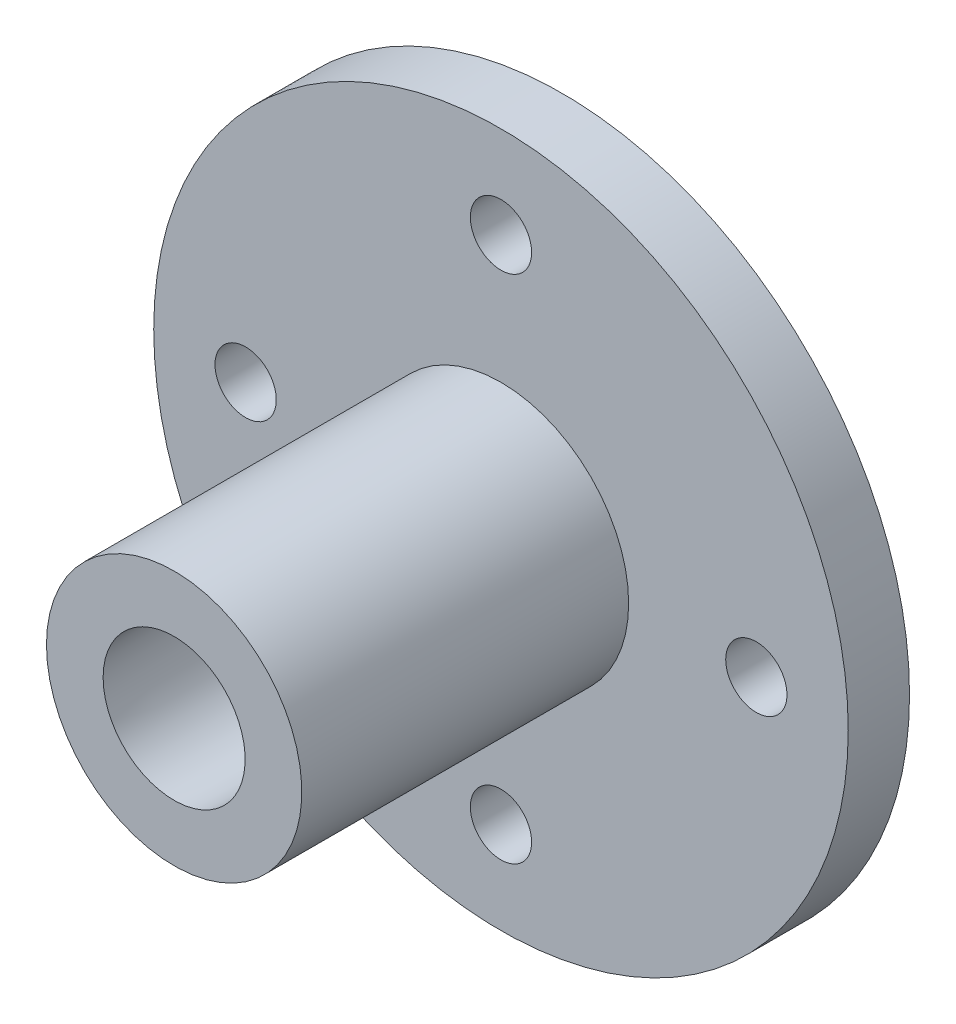
from build123d import *

# Parameters (mm, degrees)
SKETCH1_R           = 17
BOSS_EXTRUDE1_DEPTH = 3
SKETCH2_R           = 1.5
CUT_EXTRUDE1_DEPTH  = 25.228082879
SKETCH3_R           = 6.25
BOSS_EXTRUDE2_DEPTH = 1
BOSS_EXTRUDE3_START = -20
SKETCH5_R           = 6.25
BOSS_EXTRUDE3_DEPTH = 20
SKETCH6_R           = 4
CUT_EXTRUDE2_DEPTH  = 32.272991542
CUT_EXTRUDE2_DRAFT  = -1.5
SKETCH7_R           = 1.85
SKETCH7_R_2         = 1.5
CUT_EXTRUDE3_DEPTH  = 0.25


with BuildPart() as part:
    # Sketch1 → Boss-Extrude1 (new body)
    with BuildSketch(Plane.XY):
        Circle(SKETCH1_R)
    extrude(amount=BOSS_EXTRUDE1_DEPTH)

    # Sketch2 → Cut-Extrude1 (cut, through all)
    with BuildSketch(Plane(origin=(0, 0, 0), x_dir=(-1, 0, 0), z_dir=(0, 0, -1))):
        with Locations((0, 12.5)):
            Circle(SKETCH2_R)
        with Locations((12.5, 0)):
            Circle(SKETCH2_R)
        with Locations((0, -12.5)):
            Circle(SKETCH2_R)
        with Locations((-12.5, 0)):
            Circle(SKETCH2_R)
    extrude(amount=-CUT_EXTRUDE1_DEPTH, mode=Mode.SUBTRACT)

    # Sketch3 → Boss-Extrude2 (add)
    with BuildSketch(Plane(origin=(0, 0, 0), x_dir=(-1, 0, 0), z_dir=(0, 0, -1))):
        with Locations(Location((0, 0, 0), (0, 0, 180))):
            Circle(SKETCH3_R)
    extrude(amount=BOSS_EXTRUDE2_DEPTH)

    # Sketch5 → Boss-Extrude3 (add)
    with BuildSketch(Plane(origin=(0, 0, -1), x_dir=(-1, 0, 0), z_dir=(0, 0, -1)).offset(BOSS_EXTRUDE3_START)):
        with Locations(Location((0, 0, 0), (0, 0, 180))):
            Circle(SKETCH5_R)
    extrude(amount=BOSS_EXTRUDE3_DEPTH)


with BuildPart() as cut_extrude2_tool:
    # Sketch6 → Cut-Extrude2 (with draft: the straight prism first)
    with BuildSketch(Plane(origin=(0, 0, -1), x_dir=(-1, 0, 0), z_dir=(0, 0, -1))):
        Circle(SKETCH6_R)
    extrude(amount=-CUT_EXTRUDE2_DEPTH)
    # Cut-Extrude2: the draft: its side faces are tilted about the plane it starts from
    cut_extrude2_sides = [cut_extrude2_tool.faces().sort_by_distance(p)[0] for p in [
        (4, 0, 15.136495771),
    ]]
    draft(cut_extrude2_sides, Plane(origin=(0, 0, -1), x_dir=(-1, 0, 0), z_dir=(0, 0, -1)), CUT_EXTRUDE2_DRAFT)


with BuildPart() as part_1:
    add(part.part)

    # Cut-Extrude2: cut by cut_extrude2_tool
    add(cut_extrude2_tool.part, mode=Mode.SUBTRACT)

    # Sketch7 → Cut-Extrude3 (cut)
    # profile 1 of 4: a face of its own
    with BuildSketch(Plane(origin=(0, 0, 0), x_dir=(-1, 0, 0), z_dir=(0, 0, -1))):
        with Locations((0, 12.5)):
            Circle(SKETCH7_R)
        with Locations((0, 12.5)):
            Circle(SKETCH7_R_2, mode=Mode.SUBTRACT)
    # profile 2 of 4: a face of its own
    with BuildSketch(Plane(origin=(0, 0, 0), x_dir=(-1, 0, 0), z_dir=(0, 0, -1))):
        with Locations((12.5, 0)):
            Circle(SKETCH7_R)
        with Locations((12.5, 0)):
            Circle(SKETCH7_R_2, mode=Mode.SUBTRACT)
    # profile 3 of 4: a face of its own
    with BuildSketch(Plane(origin=(0, 0, 0), x_dir=(-1, 0, 0), z_dir=(0, 0, -1))):
        with Locations((0, -12.5)):
            Circle(SKETCH7_R)
        with Locations((0, -12.5)):
            Circle(SKETCH7_R_2, mode=Mode.SUBTRACT)
    # profile 4 of 4: a face of its own
    with BuildSketch(Plane(origin=(0, 0, 0), x_dir=(-1, 0, 0), z_dir=(0, 0, -1))):
        with Locations((-12.5, 0)):
            Circle(SKETCH7_R)
        with Locations((-12.5, 0)):
            Circle(SKETCH7_R_2, mode=Mode.SUBTRACT)
    extrude(amount=-CUT_EXTRUDE3_DEPTH, mode=Mode.SUBTRACT)


solid = part_1.part
